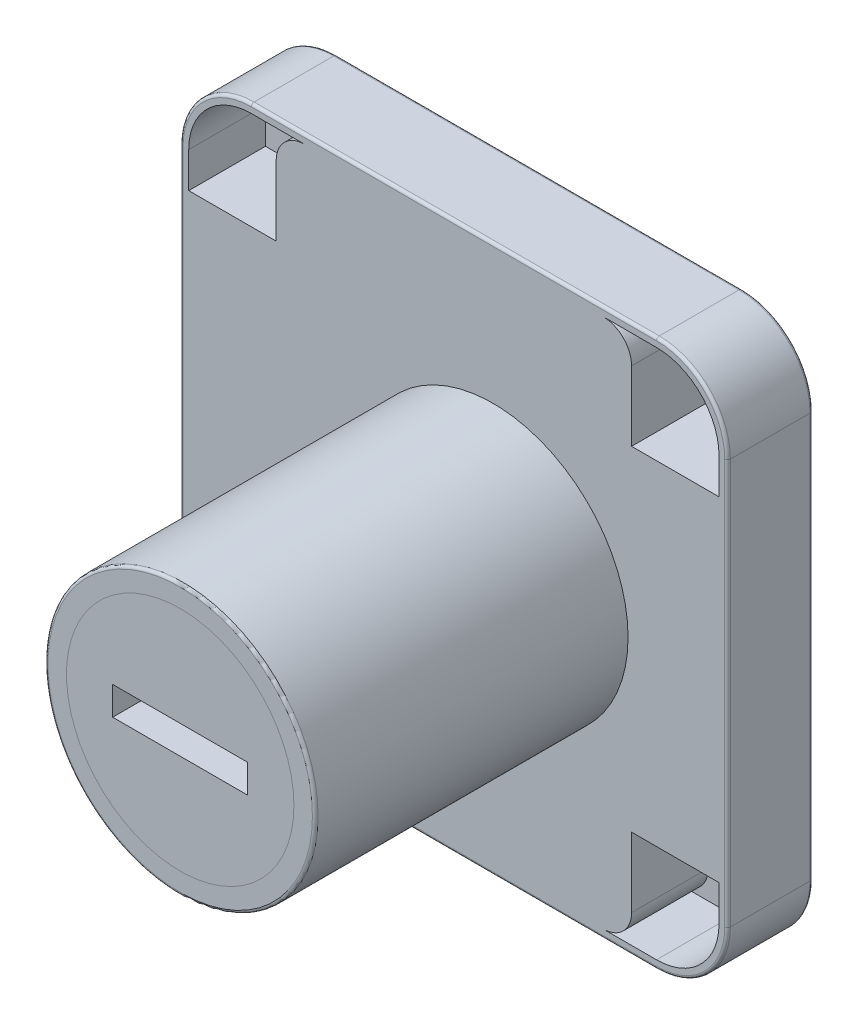
from build123d import *

# Parameters (mm, degrees)
SKETCH_1_W          = 38.5
SKETCH_1_H          = 38.5
EXTRUDE_1_DEPTH     = 6
FILLET_1_R          = 5
SHELL_1_T           = -0.6
EXTRUDE_2_DEPTH     = 5.4
SKETCH_3_R          = 9.5
SKETCH_3_R_2        = 8
EXTRUDE_1_2_DEPTH   = 22
SKETCH_4_R          = 8
EXTRUDE_3_DEPTH     = 22
SKETCH_5_W          = 9.5
SKETCH_5_H          = 2
CUT_EXTRUDE_1_DEPTH = 5
FILLET_2_R          = 0.2
SKETCH_6_R          = 2.5
CUT_EXTRUDE_2_DEPTH = 10


with BuildPart() as part:
    # 草图1 → Extrude 1 (new body)
    with BuildSketch(Plane.XY):
        Rectangle(SKETCH_1_W, SKETCH_1_H)
    extrude(amount=EXTRUDE_1_DEPTH)

    # 圆角1
    fillet_1_edges = [part.edges().sort_by_distance(p)[0] for p in [
        (-19.25, 19.25, 3),
        (19.25, 19.25, 3),
        (19.25, -19.25, 3),
        (-19.25, -19.25, 3),
    ]]
    fillet(fillet_1_edges, radius=FILLET_1_R)

    # 抽壳1
    shell_1_openings = [part.faces().sort_by_distance(p)[0] for p in [
        (0, 0, 6),
    ]]
    offset(amount=SHELL_1_T, openings=shell_1_openings, kind=Kind.INTERSECTION)



with BuildPart() as body_2:
    # 草图2 → 凸台-拉伸2 (new body)
    with BuildSketch(Plane.XY.offset(6)):
        with BuildLine():
            Line((-12.5, 16.65), (-12.5, 11.75))
            Line((-12.5, 11.75), (-18.65, 11.75))
            Line((-18.65, 11.75), (-18.65, -11.75))
            Line((-18.65, -11.75), (-12.5, -11.75))
            Line((-12.5, -11.75), (-12.5, -16.65))
            ThreePointArc((-12.5, -16.65), (-11.914213562, -18.064213562), (-10.5, -18.65))
            Line((-10.5, -18.65), (10.5, -18.65))
            ThreePointArc((10.5, -18.65), (11.914213562, -18.064213562), (12.5, -16.65))
            Line((12.5, -16.65), (12.5, -11.75))
            Line((12.5, -11.75), (18.65, -11.75))
            Line((18.65, -11.75), (18.65, 11.75))
            Line((18.65, 11.75), (12.5, 11.75))
            Line((12.5, 11.75), (12.5, 16.65))
            ThreePointArc((12.5, 16.65), (11.914213562, 18.064213562), (10.5, 18.65))
            Line((10.5, 18.65), (-10.5, 18.65))
            ThreePointArc((-10.5, 18.65), (-11.914213562, 18.064213562), (-12.5, 16.65))
        make_face()
    extrude(amount=-EXTRUDE_2_DEPTH)


with BuildPart() as part_1:
    add(part.part)

    add(body_2.part)  # Extrude 1 2 merges body 2
    # 草图3 → Extrude 1 2 (add)
    with BuildSketch(Plane.XY.offset(6)):
        with Locations((2.75, 0)):
            Circle(SKETCH_3_R)
        with Locations((2.75, 0)):
            Circle(SKETCH_3_R_2, mode=Mode.SUBTRACT)
    extrude(amount=EXTRUDE_1_2_DEPTH)

    # 圆角2
    fillet_2_edges = [part_1.edges().sort_by_distance(p)[0] for p in [
        (0, -19.25, 0),
        (0, -19.25, 6),
        (-19.25, 0, 0),
        (0, 19.25, 0),
        (19.25, 0, 0),
        (-17.785533906, 17.785533906, 0),
        (17.785533906, 17.785533906, 0),
        (17.785533906, -17.785533906, 0),
        (-17.785533906, -17.785533906, 0),
        (-19.25, 0, 6),
        (19.25, 0, 6),
        (0, 19.25, 6),
        (-17.785533906, 17.785533906, 6),
        (17.785533906, 17.785533906, 6),
        (17.785533906, -17.785533906, 6),
        (-17.785533906, -17.785533906, 6),
        (-6.75, 0, 28),
    ]]
    fillet(fillet_2_edges, radius=FILLET_2_R)

    # 草图6 → 切除-拉伸2 (cut)
    with BuildSketch(Plane(origin=(0, 0, 0), x_dir=(-1, 0, 0), z_dir=(0, 0, -1))):
        with Locations((-15, 15)):
            Circle(SKETCH_6_R)
        with Locations((15, 15)):
            Circle(SKETCH_6_R)
        with Locations((15, -15)):
            Circle(SKETCH_6_R)
        with Locations((-15, -15)):
            Circle(SKETCH_6_R)
    extrude(amount=-CUT_EXTRUDE_2_DEPTH, mode=Mode.SUBTRACT)


with BuildPart() as body_2_2:
    # 草图4 → 凸台-拉伸3 (new body)
    with BuildSketch(Plane.XY.offset(28)):
        with Locations((2.75, 0)):
            Circle(SKETCH_4_R)
    extrude(amount=-EXTRUDE_3_DEPTH)

    # 草图5 → 切除-拉伸1 (cut)
    with BuildSketch(Plane.XY.offset(28)):
        with Locations((2.75, 0)):
            Rectangle(SKETCH_5_W, SKETCH_5_H)
    extrude(amount=-CUT_EXTRUDE_1_DEPTH, mode=Mode.SUBTRACT)


solid = Compound([part_1.part, body_2_2.part])
